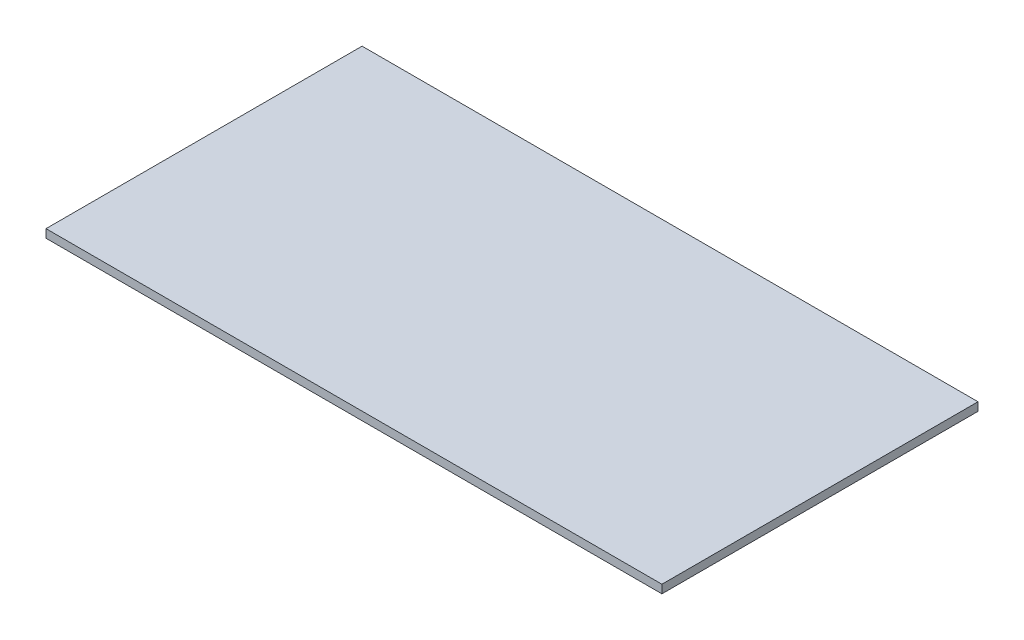
from build123d import *

# Parameters (mm, degrees)
SKETCH1_W           = 147.7
SKETCH1_H           = 75.8
BOSS_EXTRUDE1_DEPTH = 2


with BuildPart() as part:
    # Sketch1 → Boss-Extrude1 (new body)
    with BuildSketch(Plane(origin=(0, 0, 0), x_dir=(1, 0, 0), z_dir=(0, 1, 0))):
        Rectangle(SKETCH1_W, SKETCH1_H)
    extrude(amount=BOSS_EXTRUDE1_DEPTH)


solid = part.part
